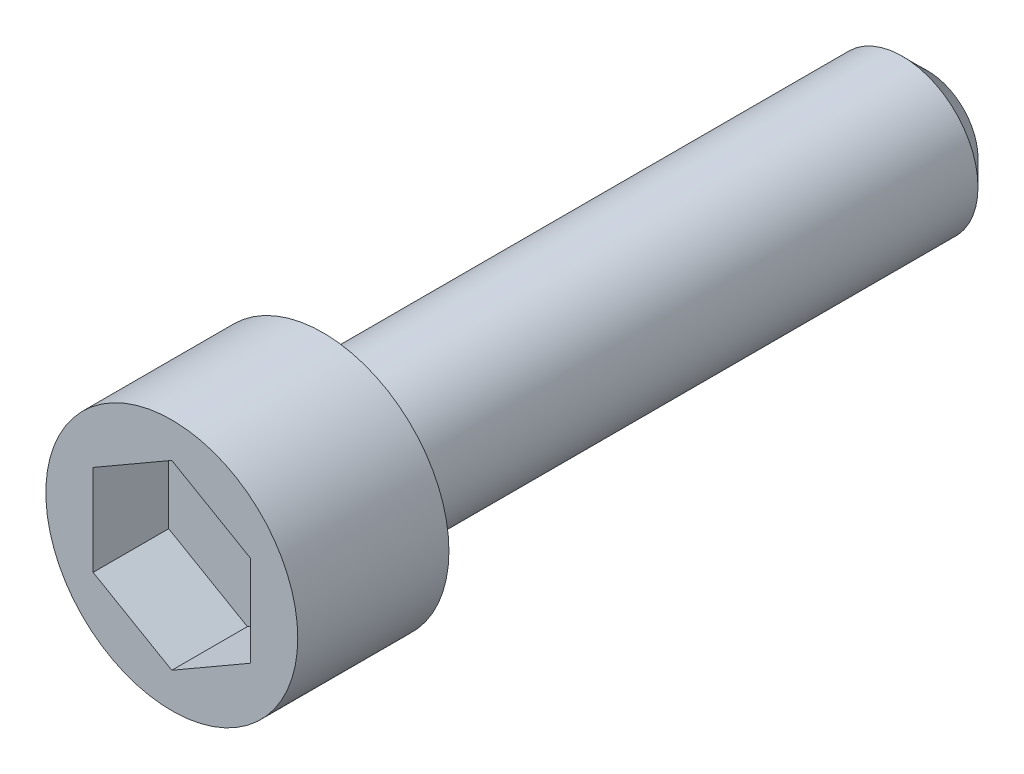
from build123d import *

# Parameters (mm, degrees)
SKETCH_1_R          = 1.5
EXTRUDE_1_DEPTH     = 12
SKETCH_2_R          = 2.5
EXTRUDE_2_DEPTH     = 3
CUT_EXTRUDE_1_DEPTH = 1.5
CHAMFER_1_SIZE      = 0.5


with BuildPart() as part:
    # 草图1 → 凸台-拉伸1 (new body)
    with BuildSketch(Plane.XY):
        Circle(SKETCH_1_R)
    extrude(amount=EXTRUDE_1_DEPTH)

    # 草图2 → 凸台-拉伸2 (add)
    with BuildSketch(Plane.XY.offset(12)):
        Circle(SKETCH_2_R)
    extrude(amount=EXTRUDE_2_DEPTH)

    # 草图3 → 切除-拉伸1 (cut)
    with BuildSketch(Plane.XY.offset(15)):
        Polygon((0, 1.803382283), (-1.56177487, 0.901691141), (-1.56177487, -0.901691141), (0, -1.803382283), (1.56177487, -0.901691141), (1.56177487, 0.901691141), align=None)
    extrude(amount=-CUT_EXTRUDE_1_DEPTH, mode=Mode.SUBTRACT)

    # 倒角1
    chamfer_1_edges = [part.edges().sort_by_distance(p)[0] for p in [
        (-1.5, 0, 0),
    ]]
    chamfer(chamfer_1_edges, length=CHAMFER_1_SIZE)


solid = part.part
